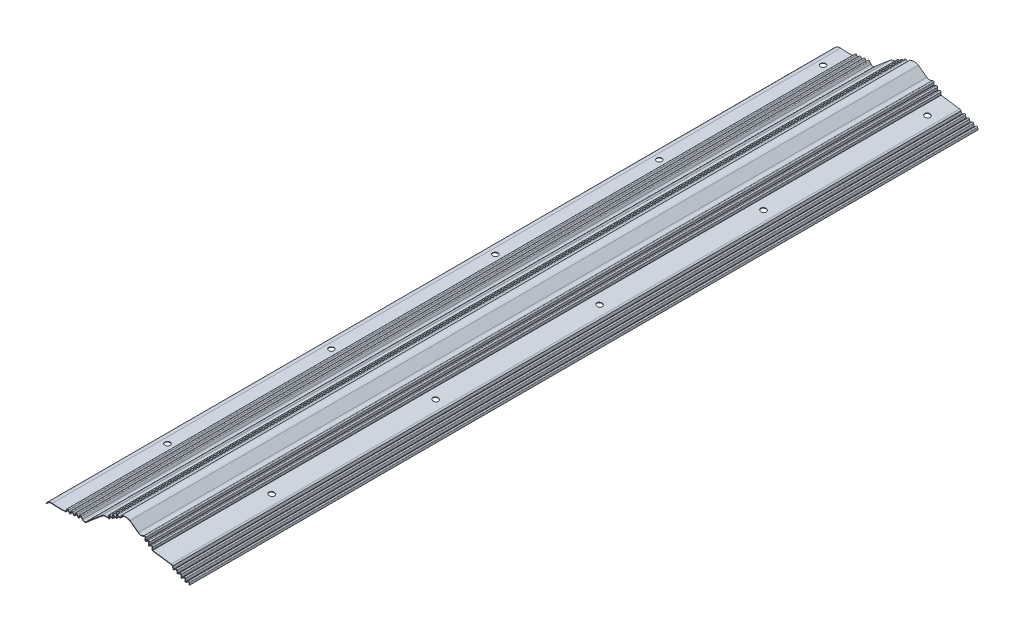
from build123d import *

# Parameters (mm, degrees)
BOSS_EXTRUDE2_DEPTH = 1462
SKETCH2_R           = 5
CUT_EXTRUDE1_DEPTH  = 1469.287435549
LPATTERN1_COUNT     = 6
LPATTERN1_PITCH     = 304


with BuildPart() as part:
    # Sketch1 → Boss-Extrude2 (new body)
    with BuildSketch(Plane.XY):
        with BuildLine():
            Line((132.155194982, -24.34565244), (131.549178211, -20.651534789))
            ThreePointArc((131.549178211, -20.651534789), (131.071271369, -20.070274566), (130.32941226, -20.196383488))
            Line((130.32941226, -20.196383488), (126.702263688, -23.213897317))
            ThreePointArc((126.702263688, -23.213897317), (125.571867586, -23.297691211), (124.838498834, -22.433407093))
            Line((124.838498834, -22.433407093), (124.070969195, -17.754749793))
            ThreePointArc((124.070969195, -17.754749793), (123.593062353, -17.17348957), (122.851203244, -17.299598492))
            Line((122.851203244, -17.299598492), (119.225487436, -20.31592037))
            ThreePointArc((119.225487436, -20.31592037), (118.094386366, -20.400988468), (117.360191704, -19.53635883))
            Line((117.360191704, -19.53635883), (116.592662065, -14.857701531))
            ThreePointArc((116.592662065, -14.857701531), (116.114755222, -14.276441307), (115.372896114, -14.402550229))
            Line((115.372896114, -14.402550229), (111.747180305, -17.418872107))
            ThreePointArc((111.747180305, -17.418872107), (110.616079236, -17.503940205), (109.881884574, -16.639310567))
            Line((109.881884574, -16.639310567), (109.114354934, -11.960653268))
            ThreePointArc((109.114354934, -11.960653268), (108.636448092, -11.379393045), (107.894588983, -11.505501967))
            Line((107.894588983, -11.505501967), (104.257743466, -14.531082923))
            ThreePointArc((104.257743466, -14.531082923), (103.135733974, -14.621825169), (102.39571767, -13.773582677))
            ThreePointArc((102.39571767, -13.773582677), (101.75859557, -11.692094699), (100.929964469, -9.679164677))
            ThreePointArc((100.929964469, -9.679164677), (99.909450438, -8.86835334), (98.67380307, -8.453576902))
            ThreePointArc((98.67380307, -8.453576902), (81.579605045, -5.950537229), (64.462637059, -3.608268949))
            ThreePointArc((64.462637059, -3.608268949), (63.683082085, -3.189313306), (63.376323507, -2.359175388))
            Line((63.376323507, -2.359175388), (63.747389148, 2.367477356))
            ThreePointArc((63.747389148, 2.367477356), (63.42198826, 3.045985027), (62.671467138, 3.100541822))
            Line((62.671467138, 3.100541822), (58.430731513, 1.036522892))
            ThreePointArc((58.430731513, 1.036522892), (57.312005686, 1.223816074), (56.805338144, 2.238662966))
            Line((56.805338144, 2.238662966), (57.176403785, 6.96531571))
            ThreePointArc((57.176403785, 6.96531571), (56.851002896, 7.64382338), (56.100481775, 7.698380176))
            Line((56.100481775, 7.698380176), (51.85292927, 5.631043385))
            ThreePointArc((51.85292927, 5.631043385), (50.739948155, 5.824505098), (50.237445087, 6.836258558))
            Line((50.237445087, 6.836258558), (50.608510728, 11.562911302))
            ThreePointArc((50.608510728, 11.562911302), (50.283109839, 12.241418972), (49.532588718, 12.295975768))
            Line((49.532588718, 12.295975768), (47.539742261, 11.326032537))
            ThreePointArc((47.539742261, 11.326032537), (42.472519995, 10.404096295), (37.663250707, 12.247364273))
            ThreePointArc((37.663250707, 12.247364273), (29.938379181, 17.97284472), (22.200194833, 23.680319595))
            ThreePointArc((22.200194833, 23.680319595), (14.753164582, 25.404335139), (7.289510018, 23.753774714))
            Line((7.289510018, 23.753774714), (5.199572583, 20.16936983))
            ThreePointArc((5.199572583, 20.16936983), (4.648254697, 19.039154019), (3.39322148, 18.960218504))
            Line((3.39322148, 18.960218504), (-0.686150959, 21.376342751))
            ThreePointArc((-0.686150959, 21.376342751), (-1.439734369, 21.382629898), (-1.818352693, 20.7310352))
            Line((-1.818352693, 20.7310352), (-1.818352693, 15.997901625))
            ThreePointArc((-1.818352693, 15.997901625), (-2.478798889, 15.074404964), (-3.614126757, 15.066287469))
            Line((-3.614126757, 15.066287469), (-7.693499195, 17.482411716))
            ThreePointArc((-7.693499195, 17.482411716), (-8.447082606, 17.488698863), (-8.825700929, 16.837104165))
            Line((-8.825700929, 16.837104165), (-8.825700929, 12.106270683))
            ThreePointArc((-8.825700929, 12.106270683), (-9.484933077, 11.179667271), (-10.622078093, 11.170605183))
            Line((-10.622078093, 11.170605183), (-14.701450531, 13.58672943))
            ThreePointArc((-14.701450531, 13.58672943), (-15.455033942, 13.593016578), (-15.833652265, 12.94142188))
            Line((-15.833652265, 12.94142188), (-15.833652265, 8.223202256))
            ThreePointArc((-15.833652265, 8.223202256), (-16.443788728, 7.327199964), (-17.524674801, 7.244908353))
            ThreePointArc((-17.524674801, 7.244908353), (-19.299151199, 7.802877652), (-21.132799275, 8.115657056))
            ThreePointArc((-21.132799275, 8.115657056), (-25.535475895, 7.606357115), (-29.319202327, 5.298465842))
            ThreePointArc((-29.319202327, 5.298465842), (-43.823146434, -6.734530982), (-57.989093646, -19.163663968))
            ThreePointArc((-57.989093646, -19.163663968), (-62.150922176, -20.507062808), (-65.921325067, -18.291301267))
            Line((-65.921325067, -18.291301267), (-68.635713192, -14.470775285))
            ThreePointArc((-68.635713192, -14.470775285), (-69.320477945, -14.158756648), (-69.931387877, -14.598128304))
            Line((-69.931387877, -14.598128304), (-71.862963024, -18.902989039))
            ThreePointArc((-71.862963024, -18.902989039), (-72.841450929, -19.474956866), (-73.879968518, -19.021010842))
            Line((-73.879968518, -19.021010842), (-76.625970986, -15.155987386))
            ThreePointArc((-76.625970986, -15.155987386), (-77.310735739, -14.843968749), (-77.921645671, -15.283340404))
            Line((-77.921645671, -15.283340404), (-79.852405266, -19.586383535))
            ThreePointArc((-79.852405266, -19.586383535), (-80.830975764, -20.159991408), (-81.870501197, -19.706104764))
            Line((-81.870501197, -19.706104764), (-84.616503664, -15.841081308))
            ThreePointArc((-84.616503664, -15.841081308), (-85.301268418, -15.529062671), (-85.91217835, -15.968434327))
            Line((-85.91217835, -15.968434327), (-87.842937944, -20.271477457))
            ThreePointArc((-87.842937944, -20.271477457), (-88.821508442, -20.84508533), (-89.861033875, -20.391198686))
            Line((-89.861033875, -20.391198686), (-92.607036343, -16.52617523))
            ThreePointArc((-92.607036343, -16.52617523), (-93.291801096, -16.214156593), (-93.902711029, -16.653528249))
            Line((-93.902711029, -16.653528249), (-95.840313578, -20.971822128))
            ThreePointArc((-95.840313578, -20.971822128), (-96.259255511, -21.374677094), (-96.814670863, -21.545902836))
            ThreePointArc((-96.814670863, -21.545902836), (-109.268664897, -21.851610444), (-121.705702139, -21.133606838))
            ThreePointArc((-121.705702139, -21.133606838), (-127.725640488, -22.203986364), (-132.300435404, -26.260662532))
            Line((-132.300435404, -26.260662532), (-133.142004571, -25.720513166))
            ThreePointArc((-133.142004571, -25.720513166), (-128.161240784, -21.303846162), (-121.60709104, -20.13848079))
            ThreePointArc((-121.60709104, -20.13848079), (-109.25210313, -20.851747599), (-96.880270296, -20.548056799))
            ThreePointArc((-96.880270296, -20.548056799), (-96.787621839, -20.524074378), (-96.710212467, -20.467801097))
            Line((-96.710212467, -20.467801097), (-94.81507711, -16.244152951))
            ThreePointArc((-94.81507711, -16.244152951), (-93.389620601, -15.218952421), (-91.791836176, -15.946995907))
            Line((-91.791836176, -15.946995907), (-89.074066404, -19.772281588))
            ThreePointArc((-89.074066404, -19.772281588), (-88.892821484, -19.847264409), (-88.713245721, -19.768367705))
            Line((-88.713245721, -19.768367705), (-86.824544431, -15.559059029))
            ThreePointArc((-86.824544431, -15.559059029), (-85.399087922, -14.533858498), (-83.801303498, -15.261901985))
            Line((-83.801303498, -15.261901985), (-81.083533725, -19.087187666))
            ThreePointArc((-81.083533725, -19.087187666), (-80.902288805, -19.162170487), (-80.722713042, -19.083273783))
            Line((-80.722713042, -19.083273783), (-78.834011752, -14.873965106))
            ThreePointArc((-78.834011752, -14.873965106), (-77.408555244, -13.848764576), (-75.810770819, -14.576808063))
            Line((-75.810770819, -14.576808063), (-73.093001047, -18.402093744))
            ThreePointArc((-73.093001047, -18.402093744), (-72.912212703, -18.477081101), (-72.73280653, -18.398844577))
            Line((-72.73280653, -18.398844577), (-70.843753958, -14.188753006))
            ThreePointArc((-70.843753958, -14.188753006), (-69.41829745, -13.163552476), (-67.820513025, -13.891595962))
            Line((-67.820513025, -13.891595962), (-65.1061249, -17.712121944))
            ThreePointArc((-65.1061249, -17.712121944), (-62.041604325, -19.513055963), (-58.658939519, -18.421163795))
            ThreePointArc((-58.658939519, -18.421163795), (-44.488072743, -5.987331857), (-29.97944835, 6.05066881))
            ThreePointArc((-29.97944835, 6.05066881), (-25.840251209, 8.559008959), (-21.031870508, 9.110550711))
            ThreePointArc((-21.031870508, 9.110550711), (-19.064555955, 8.774970791), (-17.160726488, 8.176327499))
            ThreePointArc((-17.160726488, 8.176327499), (-16.965169022, 8.182102929), (-16.833652265, 8.326945674))
            Line((-16.833652265, 8.326945674), (-16.833652265, 12.94142188))
            ThreePointArc((-16.833652265, 12.94142188), (-15.950209511, 14.461809508), (-14.19184822, 14.447139498))
            Line((-14.19184822, 14.447139498), (-10.154417359, 12.055856342))
            ThreePointArc((-10.154417359, 12.055856342), (-9.957499519, 12.061358727), (-9.825700929, 12.207769258))
            Line((-9.825700929, 12.207769258), (-9.825700929, 16.837104165))
            ThreePointArc((-9.825700929, 16.837104165), (-8.942258175, 18.357491794), (-7.183896884, 18.342821783))
            Line((-7.183896884, 18.342821783), (-3.146466023, 15.951538628))
            ThreePointArc((-3.146466023, 15.951538628), (-2.950389567, 15.956654065), (-2.818352693, 16.101700293))
            Line((-2.818352693, 16.101700293), (-2.818352693, 20.7310352))
            ThreePointArc((-2.818352693, 20.7310352), (-1.934909938, 22.251422829), (-0.176548647, 22.236752818))
            Line((-0.176548647, 22.236752818), (3.860882214, 19.845469663))
            ThreePointArc((3.860882214, 19.845469663), (4.170571687, 19.954909683), (4.104565855, 20.276667228))
            Line((4.104565855, 20.276667228), (6.579786361, 24.521862479))
            ThreePointArc((6.579786361, 24.521862479), (14.647545878, 26.404533964), (22.719463472, 24.539770734))
            ThreePointArc((22.719463472, 24.539770734), (30.496272125, 18.804006262), (38.25963851, 13.050060722))
            ThreePointArc((38.25963851, 13.050060722), (42.56540206, 11.399773413), (47.102112238, 12.225187676))
            Line((47.102112238, 12.225187676), (49.094958695, 13.195130906))
            ThreePointArc((49.094958695, 13.195130906), (50.846174645, 13.067831717), (51.605443385, 11.484647153))
            Line((51.605443385, 11.484647153), (51.238192811, 6.806590922))
            ThreePointArc((51.238192811, 6.806590922), (51.327385027, 6.634330442), (51.512920073, 6.577711797))
            Line((51.512920073, 6.577711797), (55.662851752, 8.597535314))
            ThreePointArc((55.662851752, 8.597535314), (57.414067702, 8.470236125), (58.173336442, 6.887051561))
            Line((58.173336442, 6.887051561), (57.806085868, 2.20899533))
            ThreePointArc((57.806085868, 2.20899533), (57.897088643, 2.035240792), (58.085478681, 1.980639162))
            Line((58.085478681, 1.980639162), (62.233837116, 3.999696961))
            ThreePointArc((62.233837116, 3.999696961), (63.985053065, 3.872397772), (64.744321805, 2.289213207))
            Line((64.744321805, 2.289213207), (64.377071232, -2.388843023))
            ThreePointArc((64.377071232, -2.388843023), (64.444976401, -2.541153312), (64.593555157, -2.616875762))
            ThreePointArc((64.593555157, -2.616875762), (81.719835029, -4.96041827), (98.823332552, -7.464819635))
            ThreePointArc((98.823332552, -7.464819635), (100.45328602, -8.026445508), (101.777088259, -9.130854655))
            ThreePointArc((101.777088259, -9.130854655), (102.676735408, -11.29011846), (103.364557023, -13.525892734))
            ThreePointArc((103.364557023, -13.525892734), (103.491926563, -13.68603264), (103.696225854, -13.697416363))
            Line((103.696225854, -13.697416363), (107.255043972, -10.736748315))
            ThreePointArc((107.255043972, -10.736748315), (108.986048558, -10.442494163), (110.101164524, -11.798768018))
            Line((110.101164524, -11.798768018), (110.860802899, -16.429322263))
            ThreePointArc((110.860802899, -16.429322263), (110.990638263, -16.576342407), (111.186615327, -16.584413029))
            Line((111.186615327, -16.584413029), (114.733351102, -13.633796577))
            ThreePointArc((114.733351102, -13.633796577), (116.464355689, -13.339542426), (117.579471654, -14.69581628))
            Line((117.579471654, -14.69581628), (118.339110029, -19.326370526))
            ThreePointArc((118.339110029, -19.326370526), (118.468945393, -19.47339067), (118.664922457, -19.481461291))
            Line((118.664922457, -19.481461291), (122.211658232, -16.53084484))
            ThreePointArc((122.211658232, -16.53084484), (123.942662819, -16.236590689), (125.057778784, -17.592864543))
            Line((125.057778784, -17.592864543), (125.81741716, -22.223418788))
            ThreePointArc((125.81741716, -22.223418788), (125.946887079, -22.370264614), (126.142471812, -22.378795075))
            Line((126.142471812, -22.378795075), (129.689867248, -19.427629835))
            ThreePointArc((129.689867248, -19.427629835), (131.420871835, -19.133375684), (132.5359878, -20.489649539))
            Line((132.5359878, -20.489649539), (133.142004571, -24.183767189))
            Line((133.142004571, -24.183767189), (132.155194982, -24.34565244))
        make_face()
    extrude(amount=BOSS_EXTRUDE2_DEPTH)

    # Sketch2 → Cut-Extrude1 (cut, symmetric)
    with BuildSketch(Plane(origin=(0, 0, 0), x_dir=(1, 0, 0), z_dir=(0, 1, 0))):
        with Locations((82.09052872, -42.683839539)):
            Circle(SKETCH2_R)
        with Locations((-111.146512116, -42.683839539)):
            Circle(SKETCH2_R)
    cut_extrude1 = extrude(amount=CUT_EXTRUDE1_DEPTH, both=True, mode=Mode.SUBTRACT)

    # LPattern1: Cut-Extrude1 ×6
    with Locations(*[(0, 0, i * LPATTERN1_PITCH) for i in range(1, LPATTERN1_COUNT)]):
        add(cut_extrude1, mode=Mode.SUBTRACT)


solid = part.part
